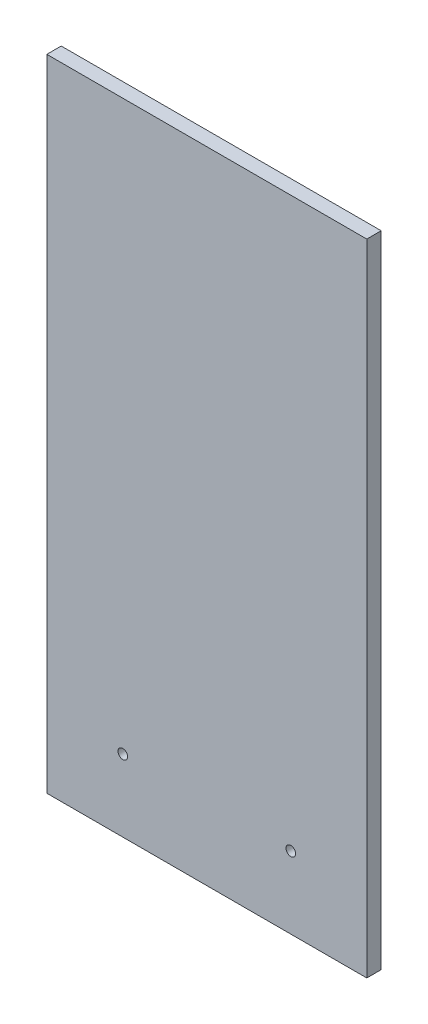
from build123d import *

# Parameters (mm, degrees)
ESQUISSE1_W                  = 400
ESQUISSE1_H                  = 800
BOSS_EXTRU_1_DEPTH           = 18
ENL_V_MAT_EXTRU_1_DEPTH      = 895.608294171
ENL_V_MAT_EXTRU_1_DEPTH_BACK = 895.608294171
ESQUISSE2_R                  = 6


with BuildPart() as part:
    # Esquisse1 → Boss.-Extru.1 (new body)
    with BuildSketch(Plane.XY):
        with Locations((200, 400)):
            Rectangle(ESQUISSE1_W, ESQUISSE1_H)
    extrude(amount=BOSS_EXTRU_1_DEPTH)

    # Esquisse2 → Enlèv. mat.-Extru.1 (cut, two sides: drawn at the far end of the back side and taken through both)
    with BuildSketch(Plane.XY.offset(18).offset(-ENL_V_MAT_EXTRU_1_DEPTH_BACK)):
        with Locations((95, 90)):
            Circle(ESQUISSE2_R)
        with Locations(Location((305, 90, 0), (0, 0, 180))):
            Circle(ESQUISSE2_R)
    extrude(amount=ENL_V_MAT_EXTRU_1_DEPTH + ENL_V_MAT_EXTRU_1_DEPTH_BACK, mode=Mode.SUBTRACT)


solid = part.part
